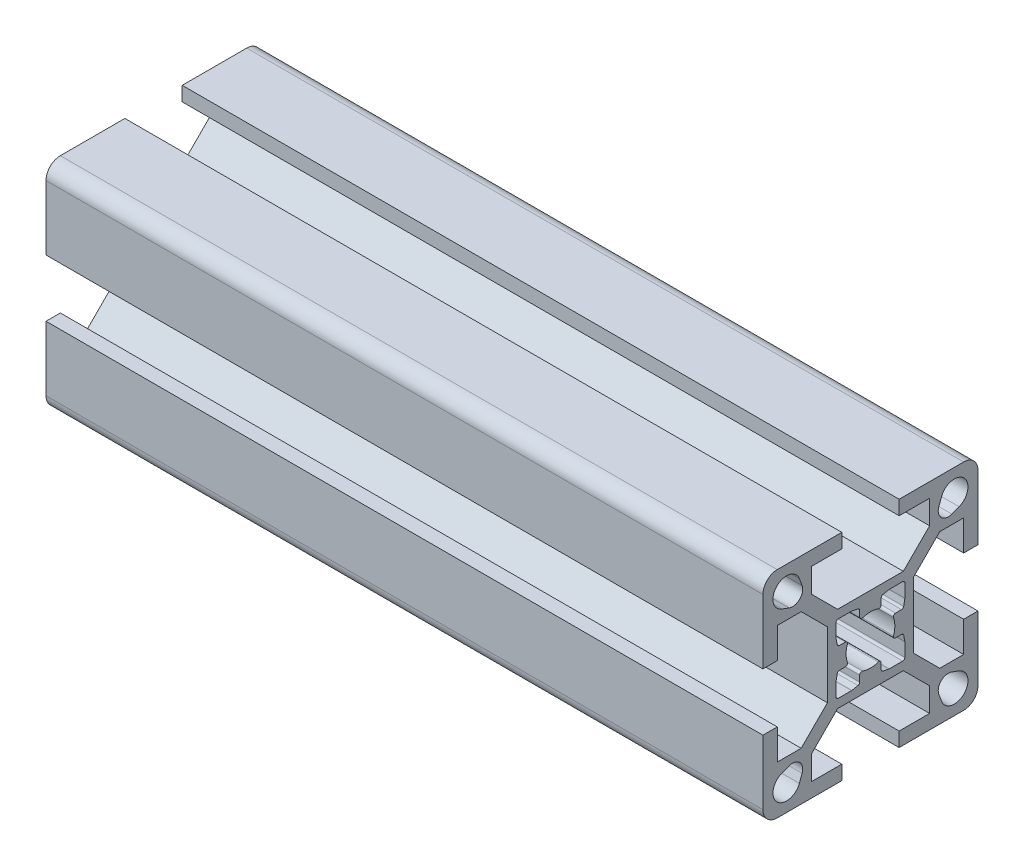
from build123d import *

# Parameters (mm, degrees)
BOSS_EXTRUDE1_DEPTH = 100


with BuildPart() as part:
    # Sketch1 → Boss-Extrude1 (new body)
    with BuildSketch(Plane(origin=(0, 0, 0), x_dir=(0, 0, -1), z_dir=(1, 0, 0))):
        with BuildLine():
            Line((-15, 13), (-15, 4))
            Line((-15, 4), (-13, 4))
            Line((-13, 4), (-13, 8.25))
            Line((-13, 8.25), (-9.664213562, 8.25))
            Line((-9.664213562, 8.25), (-6, 4.585786438))
            Line((-6, 4.585786438), (-6, -4.585786438))
            Line((-6, -4.585786438), (-9.664213562, -8.25))
            Line((-9.664213562, -8.25), (-13, -8.25))
            Line((-13, -8.25), (-13, -4))
            Line((-13, -4), (-15, -4))
            Line((-15, -4), (-15, -13))
            ThreePointArc((-15, -13), (-14.414213562, -14.414213562), (-13, -15))
            Line((-13, -15), (-4, -15))
            Line((-4, -15), (-4, -13))
            Line((-4, -13), (-8.25, -13))
            Line((-8.25, -13), (-8.25, -9.664213562))
            Line((-8.25, -9.664213562), (-4.585786438, -6))
            Line((-4.585786438, -6), (4.585786438, -6))
            Line((4.585786438, -6), (8.25, -9.664213562))
            Line((8.25, -9.664213562), (8.25, -13))
            Line((8.25, -13), (4, -13))
            Line((4, -13), (4, -15))
            Line((4, -15), (13, -15))
            ThreePointArc((13, -15), (14.414213562, -14.414213562), (15, -13))
            Line((15, -13), (15, -4))
            Line((15, -4), (13, -4))
            Line((13, -4), (13, -8.25))
            Line((13, -8.25), (9.664213562, -8.25))
            Line((9.664213562, -8.25), (6, -4.585786438))
            Line((6, -4.585786438), (6, 4.585786438))
            Line((6, 4.585786438), (9.664213562, 8.25))
            Line((9.664213562, 8.25), (13, 8.25))
            Line((13, 8.25), (13, 4))
            Line((13, 4), (15, 4))
            Line((15, 4), (15, 13))
            ThreePointArc((15, 13), (14.414213562, 14.414213562), (13, 15))
            Line((13, 15), (4, 15))
            Line((4, 15), (4, 13))
            Line((4, 13), (8.25, 13))
            Line((8.25, 13), (8.25, 9.664213562))
            Line((8.25, 9.664213562), (4.585786438, 6))
            Line((4.585786438, 6), (-4.585786438, 6))
            Line((-4.585786438, 6), (-8.25, 9.664213562))
            Line((-8.25, 9.664213562), (-8.25, 13))
            Line((-8.25, 13), (-4, 13))
            Line((-4, 13), (-4, 15))
            Line((-4, 15), (-13, 15))
            ThreePointArc((-13, 15), (-14.414213562, 14.414213562), (-15, 13))
        make_face()
        with BuildLine():
            Line((-9.539070071, 11.338915743), (-9.918883282, 12.361530981))
            ThreePointArc((-9.918883282, 12.361530981), (-13.043502884, 13.043502884), (-12.361530981, 9.918883282))
            Line((-12.361530981, 9.918883282), (-11.338915743, 9.539070071))
            ThreePointArc((-11.338915743, 9.539070071), (-9.861522369, 9.861522369), (-9.539070071, 11.338915743))
        make_face(mode=Mode.SUBTRACT)
        with BuildLine():
            Line((9.918883282, 12.361530981), (9.539070071, 11.338915743))
            ThreePointArc((9.539070071, 11.338915743), (9.861522369, 9.861522369), (11.338915743, 9.539070071))
            Line((11.338915743, 9.539070071), (12.361530981, 9.918883282))
            ThreePointArc((12.361530981, 9.918883282), (13.043502884, 13.043502884), (9.918883282, 12.361530981))
        make_face(mode=Mode.SUBTRACT)
        with BuildLine():
            Line((12.361530981, -9.918883282), (11.338915743, -9.539070071))
            ThreePointArc((11.338915743, -9.539070071), (9.861522369, -9.861522369), (9.539070071, -11.338915743))
            Line((9.539070071, -11.338915743), (9.918883282, -12.361530981))
            ThreePointArc((9.918883282, -12.361530981), (13.043502884, -13.043502884), (12.361530981, -9.918883282))
        make_face(mode=Mode.SUBTRACT)
        with BuildLine():
            Line((-11.338915743, -9.539070071), (-12.361530981, -9.918883282))
            ThreePointArc((-12.361530981, -9.918883282), (-13.043502884, -13.043502884), (-9.918883282, -12.361530981))
            Line((-9.918883282, -12.361530981), (-9.539070071, -11.338915743))
            ThreePointArc((-9.539070071, -11.338915743), (-9.861522369, -9.861522369), (-11.338915743, -9.539070071))
        make_face(mode=Mode.SUBTRACT)
        with BuildLine():
            Line((-4.8, -2.644433572), (-4.8, -4.5))
            ThreePointArc((-4.8, -4.5), (-4.712132034, -4.712132034), (-4.5, -4.8))
            Line((-4.5, -4.8), (-2.644433572, -4.8))
            ThreePointArc((-2.644433572, -4.8), (-2.615679847, -4.79861886), (-2.587190874, -4.794488155))
            Line((-2.587190874, -4.794488155), (-1.742757301, -4.630346896))
            ThreePointArc((-1.742757301, -4.630346896), (-1.568512625, -4.526682207), (-1.5, -4.335858741))
            Line((-1.5, -4.335858741), (-1.5, -3.5))
            ThreePointArc((-1.5, -3.5), (-1.374371458, -3.255879959), (-1.102702703, -3.216216216))
            ThreePointArc((-1.102702703, -3.216216216), (0, -3.4), (1.102702703, -3.216216216))
            ThreePointArc((1.102702703, -3.216216216), (1.374371458, -3.255879959), (1.5, -3.5))
            Line((1.5, -3.5), (1.5, -4.335858741))
            ThreePointArc((1.5, -4.335858741), (1.568512625, -4.526682207), (1.742757301, -4.630346896))
            Line((1.742757301, -4.630346896), (2.587190874, -4.794488155))
            ThreePointArc((2.587190874, -4.794488155), (2.615679847, -4.79861886), (2.644433572, -4.8))
            Line((2.644433572, -4.8), (4.5, -4.8))
            ThreePointArc((4.5, -4.8), (4.712132034, -4.712132034), (4.8, -4.5))
            Line((4.8, -4.5), (4.8, -2.644433572))
            ThreePointArc((4.8, -2.644433572), (4.79861886, -2.615679847), (4.794488155, -2.587190874))
            Line((4.794488155, -2.587190874), (4.630346896, -1.742757301))
            ThreePointArc((4.630346896, -1.742757301), (4.526682207, -1.568512625), (4.335858741, -1.5))
            Line((4.335858741, -1.5), (3.5, -1.5))
            ThreePointArc((3.5, -1.5), (3.255879959, -1.374371458), (3.216216216, -1.102702703))
            ThreePointArc((3.216216216, -1.102702703), (3.4, 0), (3.216216216, 1.102702703))
            ThreePointArc((3.216216216, 1.102702703), (3.255879959, 1.374371458), (3.5, 1.5))
            Line((3.5, 1.5), (4.335858741, 1.5))
            ThreePointArc((4.335858741, 1.5), (4.526682207, 1.568512625), (4.630346896, 1.742757301))
            Line((4.630346896, 1.742757301), (4.794488155, 2.587190874))
            ThreePointArc((4.794488155, 2.587190874), (4.79861886, 2.615679847), (4.8, 2.644433572))
            Line((4.8, 2.644433572), (4.8, 4.5))
            ThreePointArc((4.8, 4.5), (4.712132034, 4.712132034), (4.5, 4.8))
            Line((4.5, 4.8), (2.644433572, 4.8))
            ThreePointArc((2.644433572, 4.8), (2.615679847, 4.79861886), (2.587190874, 4.794488155))
            Line((2.587190874, 4.794488155), (1.742757301, 4.630346896))
            ThreePointArc((1.742757301, 4.630346896), (1.568512625, 4.526682207), (1.5, 4.335858741))
            Line((1.5, 4.335858741), (1.5, 3.5))
            ThreePointArc((1.5, 3.5), (1.374371458, 3.255879959), (1.102702703, 3.216216216))
            ThreePointArc((1.102702703, 3.216216216), (0, 3.4), (-1.102702703, 3.216216216))
            ThreePointArc((-1.102702703, 3.216216216), (-1.374371458, 3.255879959), (-1.5, 3.5))
            Line((-1.5, 3.5), (-1.5, 4.335858741))
            ThreePointArc((-1.5, 4.335858741), (-1.568512625, 4.526682207), (-1.742757301, 4.630346896))
            Line((-1.742757301, 4.630346896), (-2.587190874, 4.794488155))
            ThreePointArc((-2.587190874, 4.794488155), (-2.615679847, 4.79861886), (-2.644433572, 4.8))
            Line((-2.644433572, 4.8), (-4.5, 4.8))
            ThreePointArc((-4.5, 4.8), (-4.712132034, 4.712132034), (-4.8, 4.5))
            Line((-4.8, 4.5), (-4.8, 2.644433572))
            ThreePointArc((-4.8, 2.644433572), (-4.79861886, 2.615679847), (-4.794488155, 2.587190874))
            Line((-4.794488155, 2.587190874), (-4.630346896, 1.742757301))
            ThreePointArc((-4.630346896, 1.742757301), (-4.526682207, 1.568512625), (-4.335858741, 1.5))
            Line((-4.335858741, 1.5), (-3.5, 1.5))
            ThreePointArc((-3.5, 1.5), (-3.255879959, 1.374371458), (-3.216216216, 1.102702703))
            ThreePointArc((-3.216216216, 1.102702703), (-3.4, 0), (-3.216216216, -1.102702703))
            ThreePointArc((-3.216216216, -1.102702703), (-3.255879959, -1.374371458), (-3.5, -1.5))
            Line((-3.5, -1.5), (-4.335858741, -1.5))
            ThreePointArc((-4.335858741, -1.5), (-4.526682207, -1.568512625), (-4.630346896, -1.742757301))
            Line((-4.630346896, -1.742757301), (-4.794488155, -2.587190874))
            ThreePointArc((-4.794488155, -2.587190874), (-4.79861886, -2.615679847), (-4.8, -2.644433572))
        make_face(mode=Mode.SUBTRACT)
    extrude(amount=BOSS_EXTRUDE1_DEPTH)


solid = part.part
